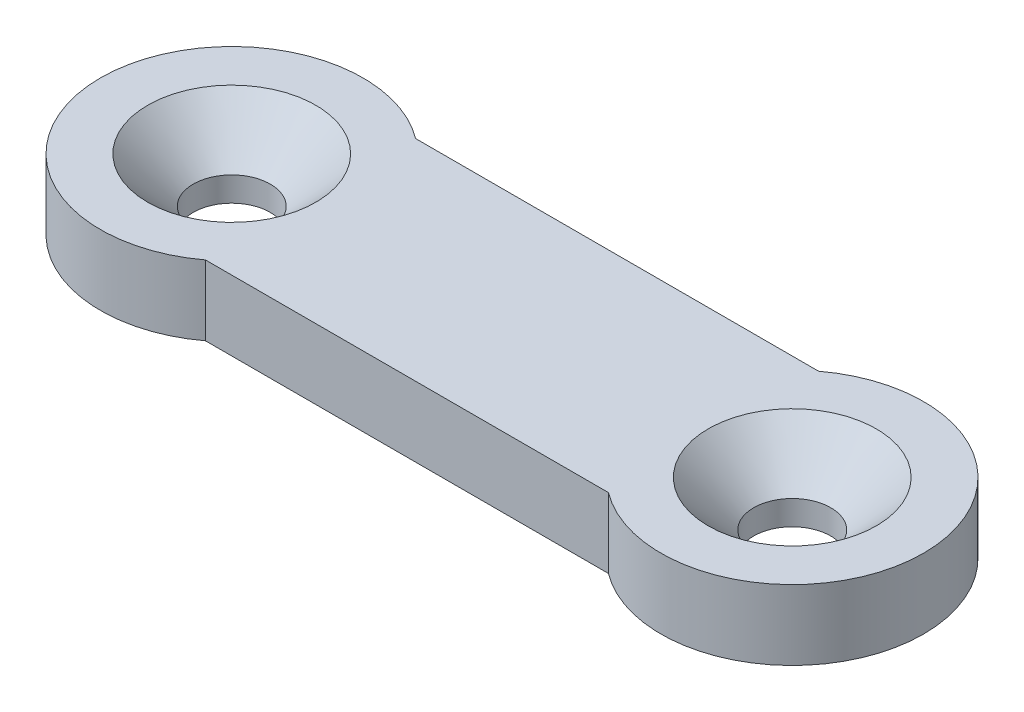
from build123d import *

# Parameters (mm, degrees)
SKETCH1_R           = 1.1
BOSS_EXTRUDE1_DEPTH = 2
BOSS_EXTRUDE3_START = -2
SKETCH3_R           = 3.75
SKETCH3_R_2         = 1.1
BOSS_EXTRUDE3_DEPTH = 2
CHAMFER1_SIZE       = 1.3


with BuildPart() as part:
    # Sketch1 → Boss-Extrude1 (new body)
    with BuildSketch(Plane(origin=(0, 0, 0), x_dir=(1, 0, 0), z_dir=(0, 1, 0))):
        with BuildLine():
            Line((-8, 3), (8, 3))
            ThreePointArc((8, 3), (11, 0), (8, -3))
            Line((8, -3), (-8, -3))
            ThreePointArc((-8, -3), (-11, 0), (-8, 3))
        make_face()
        with Locations(Location((-8, 0, 0), (0, 0, 270))):
            Circle(SKETCH1_R, mode=Mode.SUBTRACT)
        with Locations(Location((8, 0, 0), (0, 0, 270))):
            Circle(SKETCH1_R, mode=Mode.SUBTRACT)
    extrude(amount=BOSS_EXTRUDE1_DEPTH)

    # Sketch3 → Boss-Extrude3 (add)
    # profile 1 of 2: a face of its own
    with BuildSketch(Plane(origin=(0, 2, 0), x_dir=(1, 0, 0), z_dir=(0, 1, 0)).offset(BOSS_EXTRUDE3_START)):
        with Locations((-8, 0)):
            Circle(SKETCH3_R)
        with Locations(Location((-8, 0, 0), (0, 0, 270))):
            Circle(SKETCH3_R_2, mode=Mode.SUBTRACT)
    # profile 2 of 2: a face of its own
    with BuildSketch(Plane(origin=(0, 2, 0), x_dir=(1, 0, 0), z_dir=(0, 1, 0)).offset(BOSS_EXTRUDE3_START)):
        with Locations((8, 0)):
            Circle(SKETCH3_R)
        with Locations(Location((8, 0, 0), (0, 0, 270))):
            Circle(SKETCH3_R_2, mode=Mode.SUBTRACT)
    extrude(amount=BOSS_EXTRUDE3_DEPTH)

    # Chamfer1
    chamfer1_edges = [part.edges().sort_by_distance(p)[0] for p in [
        (-8, 2, -1.1),
        (8, 2, -1.1),
    ]]
    chamfer(chamfer1_edges, length=CHAMFER1_SIZE)


solid = part.part
